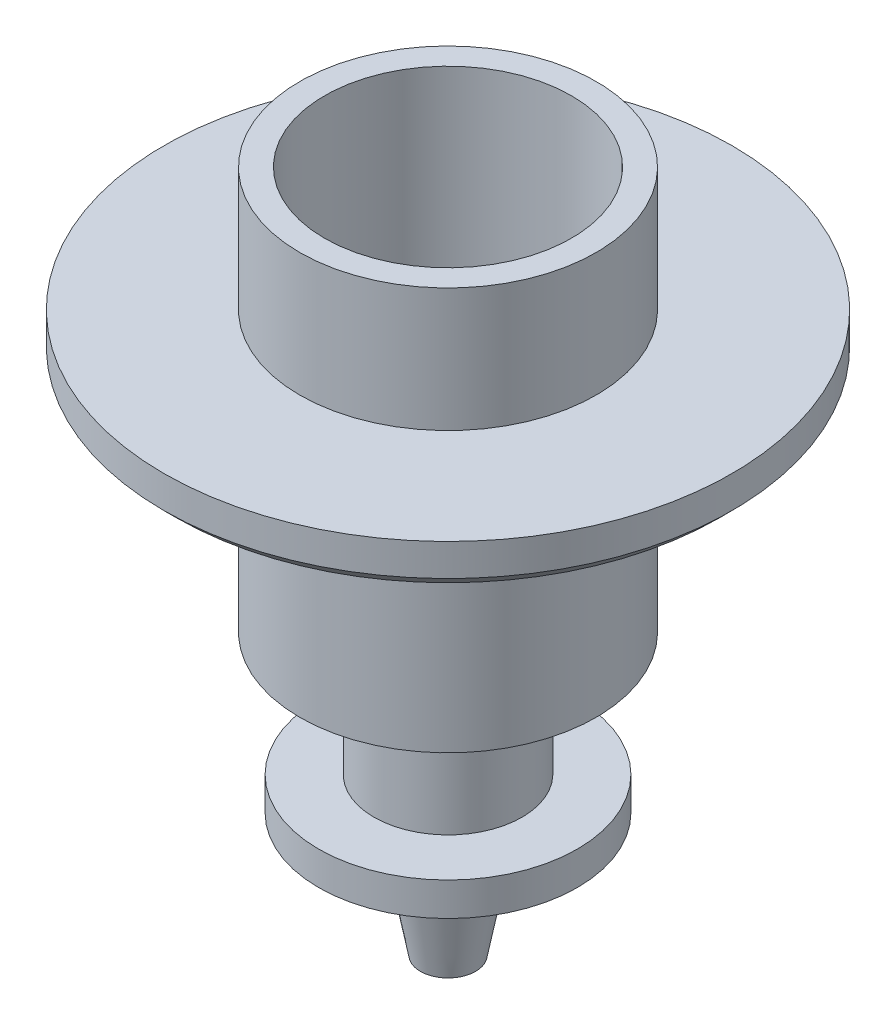
from build123d import *

# Parameters (mm, degrees)
SKETCH2_R          = 0.3
CUT_EXTRUDE1_DEPTH = 17.038105375
SKETCH2_3_R        = 2.5
SKETCH2_3_R_2      = 0.3
CUT_EXTRUDE2_DEPTH = 7.5


with BuildPart() as part:
    # Sketch1 → Revolve1 (revolve)
    with BuildSketch(Plane.XY, mode=Mode.PRIVATE) as revolve1_sk:
        Polygon((-3, 11.528571429), (-3, 9.028571429), (-5.75, 9.028571429), (-5.75, 8.378571429), (-5.5, 8.128571429), (-3, 8.128571429), (-3, 3.378571429), (-1.62626129, 2.878571429), (-1.5, 2.878571429), (-1.5, 0.878571429), (-2.618482429, 0.878571429), (-2.618482429, 0.203307318), (-1.03161177, 0.203307318), (-0.558926893, -2.29516989), (0, -2.29516989), (0, 11.528571429), align=None)
    revolve(revolve1_sk.sketch.rotate(Axis((0, 11.528571429, 0), (0, -1, 0)), 270), axis=Axis((0, 11.528571429, 0), (0, -1, 0)))

    # Sketch2 → Cut-Extrude1 (cut, through all)
    with BuildSketch(Plane(origin=(0, 11.528571429, 0), x_dir=(1, 0, 0), z_dir=(0, 1, 0))):
        with Locations(Location((0, 0, 0), (0, 0, 270))):
            Circle(SKETCH2_R)
    extrude(amount=-CUT_EXTRUDE1_DEPTH, mode=Mode.SUBTRACT)

    # Sketch2<3> → Cut-Extrude2 (cut)
    with BuildSketch(Plane(origin=(0, 11.528571429, 0), x_dir=(1, 0, 0), z_dir=(0, 1, 0))):
        with Locations(Location((0, 0, 0), (0, 0, 270))):
            Circle(SKETCH2_3_R)
        with Locations(Location((0, 0, 0), (0, 0, 270))):
            Circle(SKETCH2_3_R_2, mode=Mode.SUBTRACT)
    extrude(amount=-CUT_EXTRUDE2_DEPTH, mode=Mode.SUBTRACT)


solid = part.part
